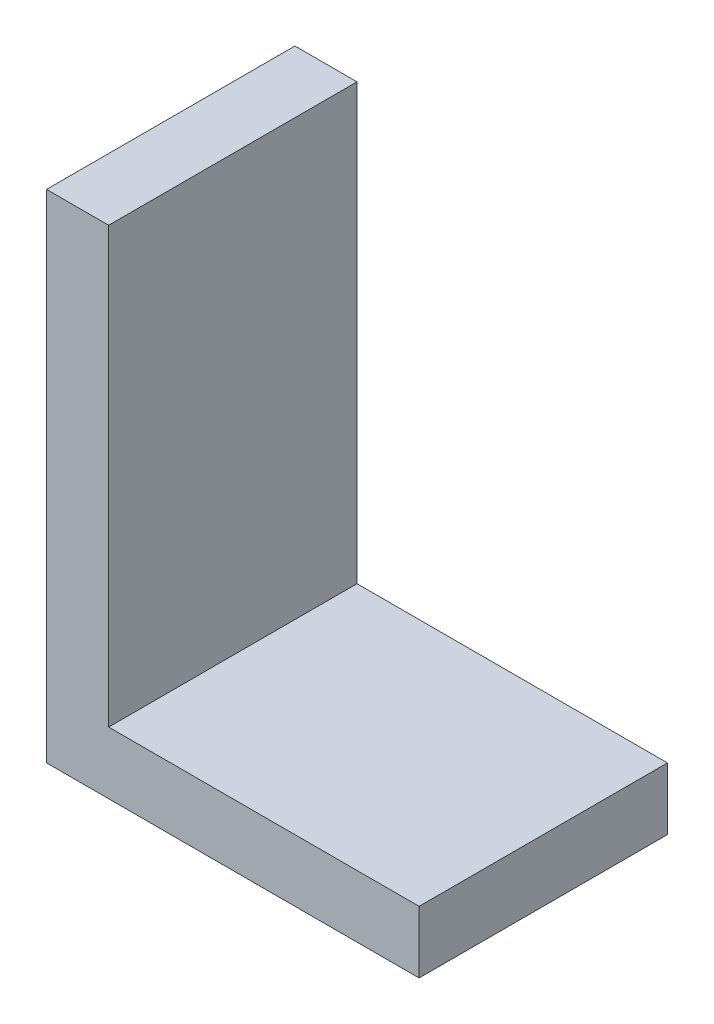
from build123d import *

# Parameters (mm, degrees)
BOSS_EXTRUDE1_DEPTH = 20


with BuildPart() as part:
    # Sketch2 → Boss-Extrude1 (new body)
    with BuildSketch(Plane.XY):
        Polygon((0, 0), (0, 40), (5, 40), (5, 5), (30, 5), (30, 0), align=None)
    extrude(amount=-BOSS_EXTRUDE1_DEPTH)


solid = part.part
